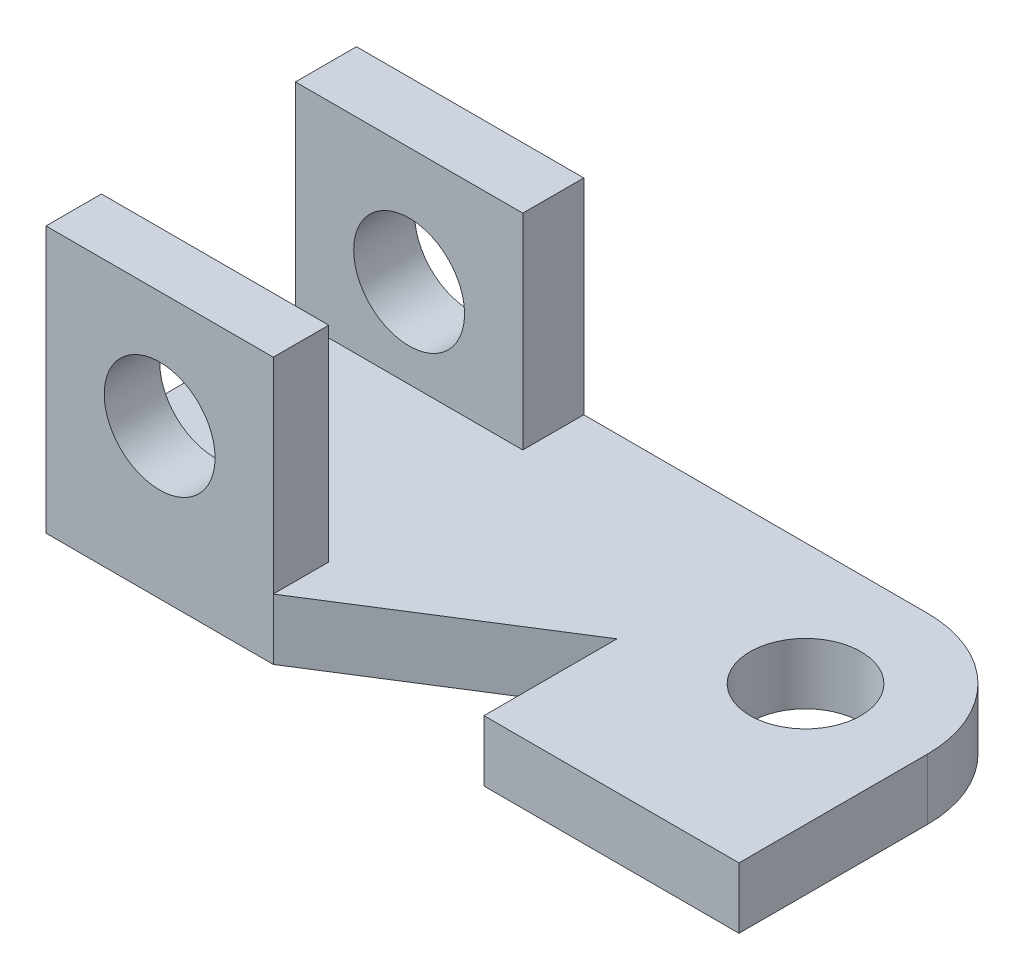
from build123d import *

# Parameters (mm, degrees)
SKETCH1_R           = 10
BOSS_EXTRUDE1_DEPTH = 11
SKETCH3_W           = 41
SKETCH3_H           = 10
BOSS_EXTRUDE2_DEPTH = 37
SKETCH4_R           = 10
CUT_EXTRUDE1_DEPTH  = 37
BOSS_EXTRUDE3_START = -11
SKETCH5_W           = 41
SKETCH5_H           = 37
SKETCH5_R           = 10
BOSS_EXTRUDE3_DEPTH = 11


with BuildPart() as part:
    # Sketch1 → Boss-Extrude1 (new body)
    with BuildSketch(Plane(origin=(0, 0, 0), x_dir=(1, 0, 0), z_dir=(0, 1, 0))):
        with BuildLine():
            Line((0, 0), (-46, 0))
            Line((-46, 0), (-46, 24))
            Line((-46, 24), (-84, 0))
            Line((-84, 0), (-125, 0))
            Line((-125, 0), (-125, 56))
            Line((-125, 56), (-22, 56))
            ThreePointArc((-22, 56), (-6.443650814, 49.556349186), (0, 34))
            Line((0, 34), (0, 0))
        make_face()
        with Locations(Location((-22, 34, 0), (0, 0, 270))):
            Circle(SKETCH1_R, mode=Mode.SUBTRACT)
    extrude(amount=BOSS_EXTRUDE1_DEPTH)

    # Sketch3 → Boss-Extrude2 (add)
    with BuildSketch(Plane(origin=(0, 11, 0), x_dir=(1, 0, 0), z_dir=(0, 1, 0))):
        with Locations((-104.5, 5)):
            Rectangle(SKETCH3_W, SKETCH3_H)
    extrude(amount=BOSS_EXTRUDE2_DEPTH)

    # Sketch4 → Cut-Extrude1 (cut)
    with BuildSketch(Plane.XY):
        with Locations((-104.5, 27)):
            Circle(SKETCH4_R)
    extrude(amount=-CUT_EXTRUDE1_DEPTH, mode=Mode.SUBTRACT)

    # Sketch5 → Boss-Extrude3 (add)
    with BuildSketch(Plane(origin=(0, 0, -56), x_dir=(-1, 0, 0), z_dir=(0, 0, -1)).offset(BOSS_EXTRUDE3_START)):
        with Locations((104.5, 29.5)):
            Rectangle(SKETCH5_W, SKETCH5_H)
        with Locations(Location((104.5, 27, 0), (0, 0, 180))):
            Circle(SKETCH5_R, mode=Mode.SUBTRACT)
    extrude(amount=BOSS_EXTRUDE3_DEPTH)


solid = part.part
